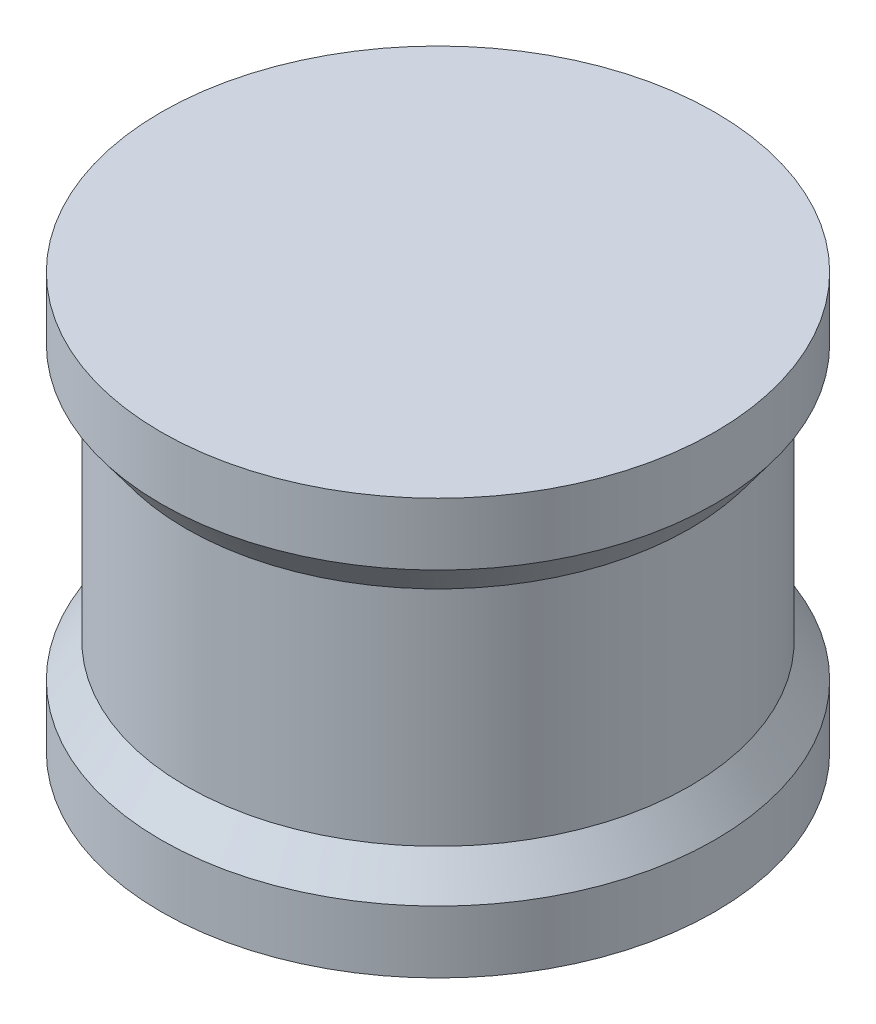
from build123d import *

# Parameters (mm, degrees)
SKETCH2_R           = 20
BOSS_EXTRUDE1_DEPTH = 30


with BuildPart() as part:
    # Sketch2 → Boss-Extrude1 (new body)
    with BuildSketch(Plane(origin=(0, 0, 0), x_dir=(1, 0, 0), z_dir=(0, 1, 0))):
        Circle(SKETCH2_R)
    extrude(amount=BOSS_EXTRUDE1_DEPTH)

    # Sketch3 → Cut-Revolve1 (revolve, cut)
    with BuildSketch(Plane.XY):
        Polygon((-20, 25.507054769), (-18.187675722, 23.049442392), (-18.187675722, 6.950557608), (-20, 4.492945231), align=None)
    revolve(axis=Axis((0, 30, 0), (0, -1, 0)), mode=Mode.SUBTRACT)


solid = part.part
